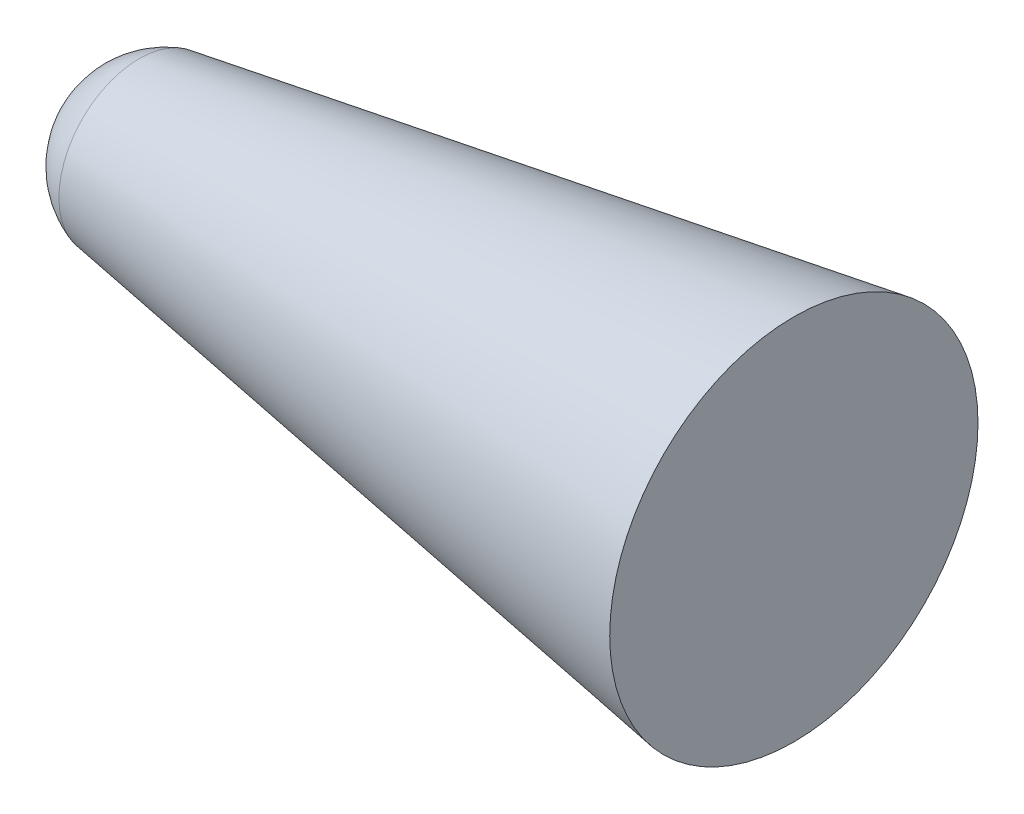
from build123d import *


with BuildPart() as part:
    # Sketch1 → Revolve4 (revolve)
    with BuildSketch(Plane.XY):
        with BuildLine():
            ThreePointArc((20.219391479, 0), (49.344299837, 89.637250975), (125.594299837, 145.036118735))
            Line((125.594299837, 145.036118735), (1305.219391479, 331.870378668))
            Line((1305.219391479, 331.870378668), (1305.219391479, 0))
            Line((1305.219391479, 0), (20.219391479, 0))
        make_face()
    revolve(axis=Axis((20.219391479, 0, 0), (1, 0, 0)))


solid = part.part
